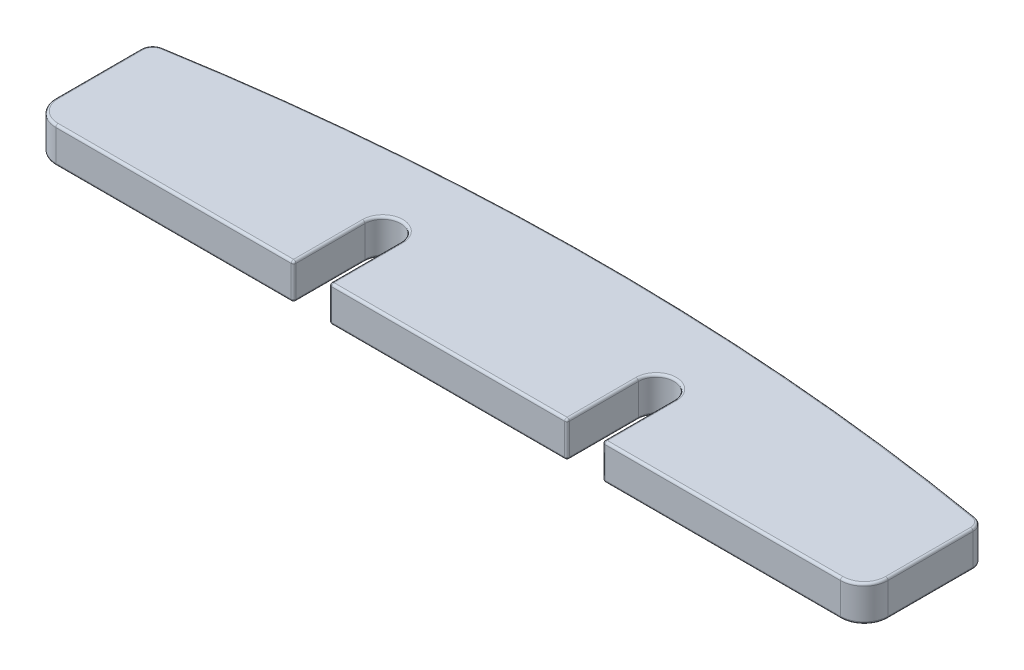
from build123d import *

# Parameters (mm, degrees)
BOSS_EXTRUDE1_DEPTH = 3
FILLET1_R           = 0.2


with BuildPart() as part:
    # Sketch1 → Boss-Extrude1 (new body)
    with BuildSketch(Plane(origin=(0, 0, 0), x_dir=(1, 0, 0), z_dir=(0, 1, 0))):
        with BuildLine():
            Line((10, 0), (-10, 0))
            Line((-10, 0), (-10, 6))
            ThreePointArc((-10, 6), (-11.5, 7.5), (-13, 6))
            Line((-13, 6), (-13, 0))
            Line((-13, 0), (-33, 0))
            ThreePointArc((-33, 0), (-34.414213562, 0.585786438), (-35, 2))
            Line((-35, 2), (-35, 9.156613858))
            ThreePointArc((-35, 9.156613858), (-34.763762616, 9.802111083), (-34.166666667, 10.142627155))
            ThreePointArc((-34.166666667, 10.142627155), (0, 13.009901233), (34.166666667, 10.142627155))
            ThreePointArc((34.166666667, 10.142627155), (34.763762616, 9.802111083), (35, 9.156613858))
            Line((35, 9.156613858), (35, 2))
            ThreePointArc((35, 2), (34.414213562, 0.585786438), (33, 0))
            Line((33, 0), (13, 0))
            Line((13, 0), (13, 6))
            ThreePointArc((13, 6), (11.5, 7.5), (10, 6))
            Line((10, 6), (10, 0))
        make_face()
    extrude(amount=BOSS_EXTRUDE1_DEPTH)

    # Fillet1
    fillet1_edges = [part.edges().sort_by_distance(p)[0] for p in [
        (10, 3, -3),
        (11.5, 3, -7.5),
        (-11.5, 0, -7.5),
        (-13, 0, -3),
        (-23, 0, 0),
        (-34.414213562, 0, -0.585786438),
        (-35, 0, -5.578306929),
        (13, 3, -3),
        (-34.763762616, 0, -9.802111083),
        (0, 0, -13.009901233),
        (34.763762616, 0, -9.802111083),
        (35, 0, -5.578306929),
        (34.414213562, 0, -0.585786438),
        (23, 0, 0),
        (13, 0, -3),
        (11.5, 0, -7.5),
        (23, 3, 0),
        (10, 0, -3),
        (0, 0, 0),
        (-10, 0, -3),
        (34.414213562, 3, -0.585786438),
        (35, 3, -5.578306929),
        (-13, 1.5, 0),
        (13, 1.5, 0),
        (10, 1.5, 0),
        (-10, 1.5, 0),
        (34.763762616, 3, -9.802111083),
        (0, 3, -13.009901233),
        (-34.763762616, 3, -9.802111083),
        (-35, 3, -5.578306929),
        (-10, 3, -3),
        (-34.414213562, 3, -0.585786438),
        (-23, 3, 0),
        (-13, 3, -3),
        (-11.5, 3, -7.5),
        (0, 3, 0),
    ]]
    fillet(fillet1_edges, radius=FILLET1_R)


solid = part.part
